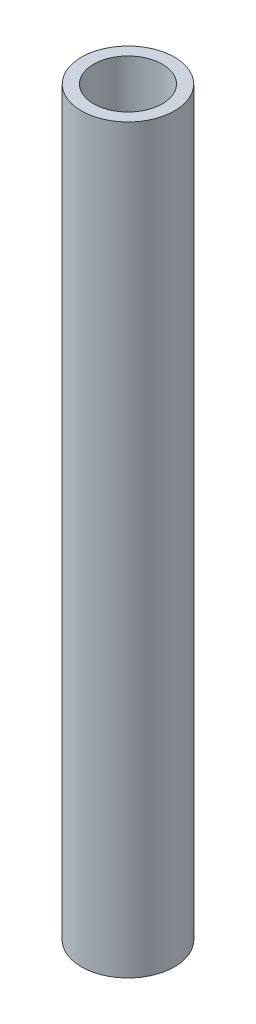
from build123d import *

# Parameters (mm, degrees)
SKETCH1_R           = 4.7498
SKETCH1_R_2         = 3.5052
BOSS_EXTRUDE1_DEPTH = 75.6412


with BuildPart() as part:
    # Sketch1 → Boss-Extrude1 (new body)
    with BuildSketch(Plane(origin=(0, 0, 0), x_dir=(1, 0, 0), z_dir=(0, 1, 0))):
        with Locations(Location((0, 0, 0), (0, 0, 270))):
            Circle(SKETCH1_R)
        with Locations(Location((0, 0, 0), (0, 0, 270))):
            Circle(SKETCH1_R_2, mode=Mode.SUBTRACT)
    extrude(amount=BOSS_EXTRUDE1_DEPTH)


solid = part.part
